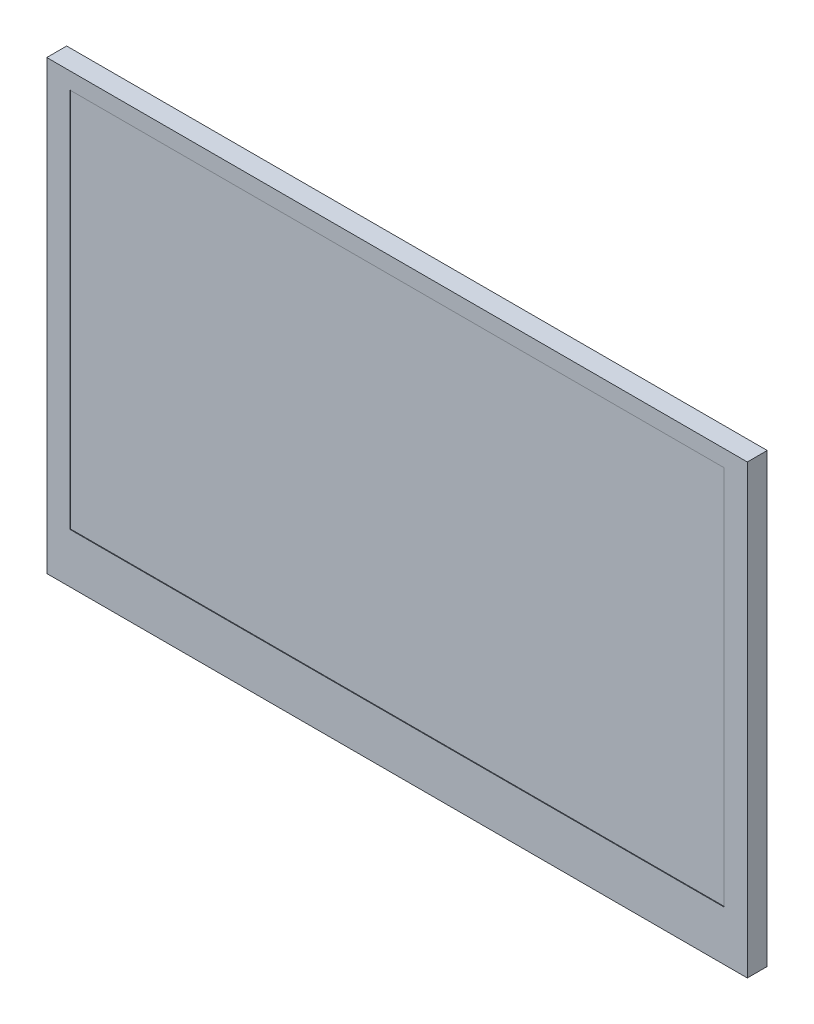
from build123d import *

# Parameters (mm, degrees)
SKETCH_1_W          = 105.5
SKETCH_1_H          = 67.3
EXTRUDE_1_DEPTH     = 3
SKETCH_2_W          = 45.5
SKETCH_2_H          = 10.549345268
EXTRUDE_2_DEPTH     = 0.1
SKETCH_3_W          = 98.5
SKETCH_3_H          = 57.3
CUT_EXTRUDE_1_DEPTH = 0.1


with BuildPart() as part:
    # 草图1 → 凸台-拉伸1 (new body)
    with BuildSketch(Plane.XY.offset(3)):
        Rectangle(SKETCH_1_W, SKETCH_1_H)
    extrude(amount=-EXTRUDE_1_DEPTH)

    # 草图2 → 凸台-拉伸2 (add)
    with BuildSketch(Plane.XZ.offset(33.65)):
        with Locations((-10, -3.274672634)):
            Rectangle(SKETCH_2_W, SKETCH_2_H)
    extrude(amount=EXTRUDE_2_DEPTH)

    # 草图3 → 切除-拉伸1 (cut)
    with BuildSketch(Plane.XY.offset(3)):
        with Locations((0, 2.5)):
            Rectangle(SKETCH_3_W, SKETCH_3_H)
    extrude(amount=-CUT_EXTRUDE_1_DEPTH, mode=Mode.SUBTRACT)


solid = part.part
